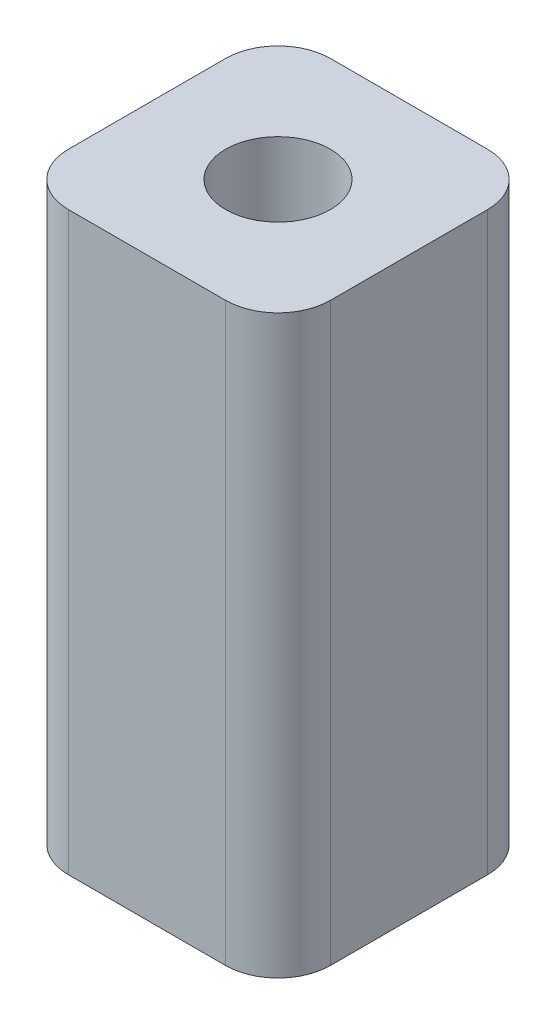
from build123d import *

# Parameters (mm, degrees)
SKETCH_1_R      = 1
EXTRUDE_1_DEPTH = 11


with BuildPart() as part:
    # Эскиз1 → Бобышка-Вытянуть1 (new body)
    with BuildSketch(Plane(origin=(0, 0, 0), x_dir=(1, 0, 0), z_dir=(0, 1, 0))):
        with BuildLine():
            Line((-1.5, 2.5), (1.5, 2.5))
            ThreePointArc((1.5, 2.5), (2.207106781, 2.207106781), (2.5, 1.5))
            Line((2.5, 1.5), (2.5, -1.5))
            ThreePointArc((2.5, -1.5), (2.207106781, -2.207106781), (1.5, -2.5))
            Line((1.5, -2.5), (-1.5, -2.5))
            ThreePointArc((-1.5, -2.5), (-2.207106781, -2.207106781), (-2.5, -1.5))
            Line((-2.5, -1.5), (-2.5, 1.5))
            ThreePointArc((-2.5, 1.5), (-2.207106781, 2.207106781), (-1.5, 2.5))
        make_face()
        with Locations(Location((0, 0, 0), (0, 0, 270))):
            Circle(SKETCH_1_R, mode=Mode.SUBTRACT)
    extrude(amount=EXTRUDE_1_DEPTH)


solid = part.part
